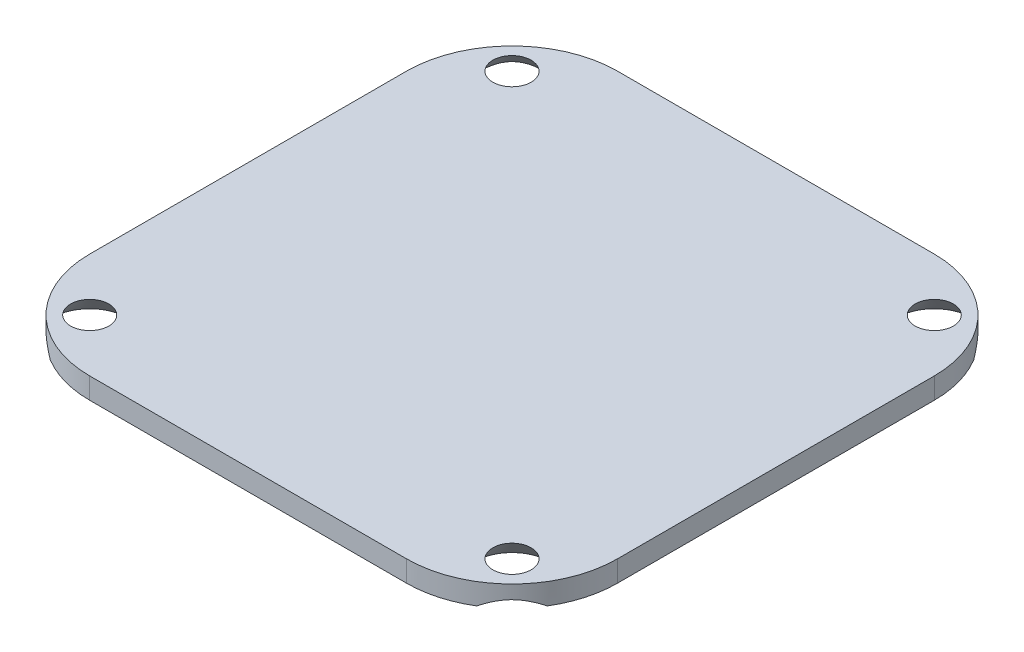
from build123d import *

# Parameters (mm, degrees)
SKETCH1_W           = 50
SKETCH1_H           = 50
BOSS_EXTRUDE1_DEPTH = 2
FILLET2_R           = 10
HOLE1_D             = 3.6
HOLE1_DEPTH         = 10
HOLE1_CSINK_D       = 7.1
HOLE1_CSINK_ANGLE   = 82


with BuildPart() as part:
    # Sketch1 → Boss-Extrude1 (new body)
    with BuildSketch(Plane(origin=(0, 0, 0), x_dir=(1, 0, 0), z_dir=(0, 1, 0))):
        Rectangle(SKETCH1_W, SKETCH1_H)
    extrude(amount=BOSS_EXTRUDE1_DEPTH)

    # Fillet2
    fillet2_edges = [part.edges().sort_by_distance(p)[0] for p in [
        (25, 1, 25),
        (-25, 1, 25),
        (-25, 1, -25),
        (25, 1, -25),
    ]]
    fillet(fillet2_edges, radius=FILLET2_R)

    # Hole1
    with Locations(Plane(origin=(-20, 0, 20), x_dir=(0, 0, -1), z_dir=(0, -1, 0))):
        with Locations((0, 0), (0, 40), (40, 40), (40, 0)):
            CounterSinkHole(HOLE1_D / 2, HOLE1_CSINK_D / 2, depth=HOLE1_DEPTH, counter_sink_angle=HOLE1_CSINK_ANGLE)


solid = part.part
